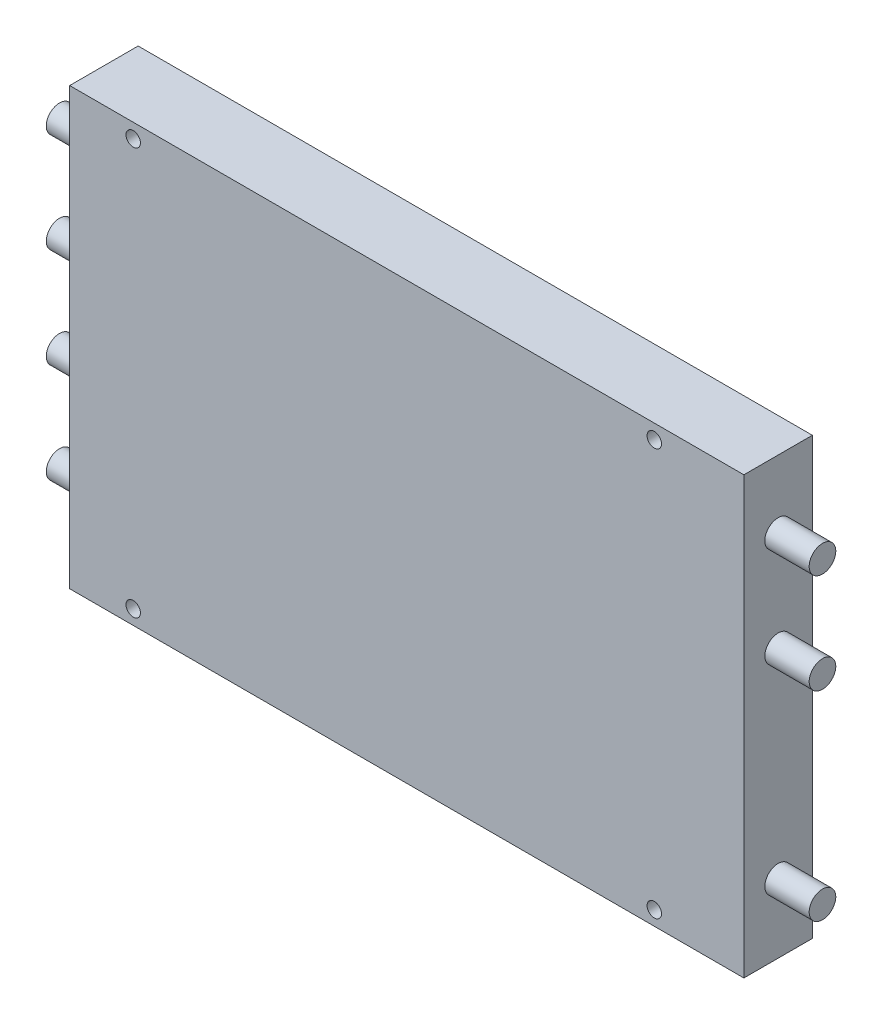
from build123d import *

# Parameters (mm, degrees)
SKETCH1_W                = 154.432
SKETCH1_H                = 99.822
BOSS_EXTRUDE1_DEPTH      = 15.6845
BOSS_EXTRUDE2_DEPTH      = 10.16
BOSS_EXTRUDE2_DEPTH_BACK = 164.592
SKETCH2_R                = 3.048
SKETCH2_3_R              = 3.048
BOSS_EXTRUDE3_DEPTH      = 10.16
SKETCH3_R                = 1.651
CUT_EXTRUDE1_DEPTH       = 102.841429866


with BuildPart() as part:
    # Sketch1 → Boss-Extrude1 (new body)
    with BuildSketch(Plane.XY):
        Rectangle(SKETCH1_W, SKETCH1_H)
    extrude(amount=BOSS_EXTRUDE1_DEPTH)

    # Sketch2 → Boss-Extrude2 (add, two sides: drawn at the far end of the back side and taken through both)
    with BuildSketch(Plane.ZY.offset(77.216).offset(-BOSS_EXTRUDE2_DEPTH_BACK)):
        with Locations((7.84225, 34.417)):
            Circle(SKETCH2_R)
        with Locations((7.84225, 11.557)):
            Circle(SKETCH2_R)
        with Locations((7.84225, -34.163)):
            Circle(SKETCH2_R)
    extrude(amount=BOSS_EXTRUDE2_DEPTH + BOSS_EXTRUDE2_DEPTH_BACK)

    # Sketch2<3> → Boss-Extrude3 (add)
    with BuildSketch(Plane.ZY.offset(77.216)):
        with Locations(Location((7.84225, -11.303, 0), (0, 0, 180))):
            Circle(SKETCH2_3_R)
    extrude(amount=BOSS_EXTRUDE3_DEPTH)

    # Sketch3 → Cut-Extrude1 (cut, through all)
    with BuildSketch(Plane.XY):
        with Locations((-62.6618, 46.609)):
            Circle(SKETCH3_R)
        with Locations((-62.6618, -46.609)):
            Circle(SKETCH3_R)
        with Locations((56.6928, -46.609)):
            Circle(SKETCH3_R)
        with Locations((56.6928, 46.609)):
            Circle(SKETCH3_R)
    extrude(amount=CUT_EXTRUDE1_DEPTH, mode=Mode.SUBTRACT)


solid = part.part
